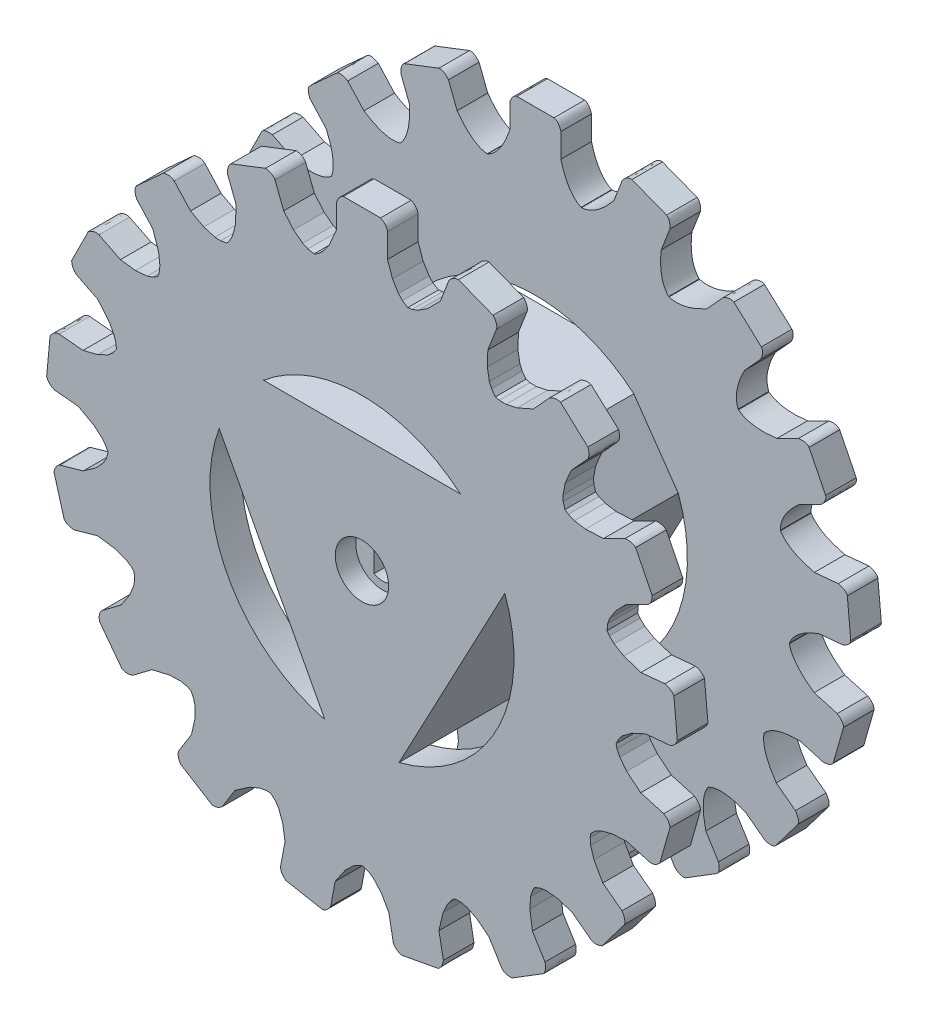
from build123d import *

# Parameters (mm, degrees)
BOSS_EXTRUDE2_DEPTH  = 3
BOSS_EXTRUDE3_DEPTH  = 14
BOSS_EXTRUDE7_DEPTH  = 3
CUT_EXTRUDE1_DEPTH   = 10
SKETCH7_R            = 2.616026973
CUT_EXTRUDE3_DEPTH   = 2
BOSS_EXTRUDE10_DEPTH = 5


with BuildPart() as part:
    # Sketch1 → Boss-Extrude2 (new body)
    with BuildSketch(Plane.XY):
        with BuildLine():
            Line((8.523768733, 28.922958261), (7.673117692, 26.727174809))
            add(Edge.make_bspline(
                [(7.673117692, 26.727174809), (5.977966967, 24.70445358), (4.514634253, 24.588982849)],
                knots=[0, 0, 0, 0.37277567, 0.37277567, 0.37277567], degree=2))
            ThreePointArc((4.514634253, 24.588982849), (4.492443696, 24.593046774), (4.470249482, 24.597090673))
            add(Edge.make_bspline(
                [(2.5, 27.6941981), (3.147445202, 25.23338067), (4.470249482, 24.597090673)],
                knots=[0, 0, 0, 0.37277567, 0.37277567, 0.37277567], degree=2))
            Line((2.5, 27.6941981), (2.5, 30.04899579))
            add(Edge.make_bspline(
                [(2.5, 30.04899579), (2.258646097, 30.79207266), (1.822349431, 30.874685911)],
                knots=[0, 0, 0, 0.57378329, 0.57378329, 0.57378329], degree=2))
            Line((1.822349431, 30.874685911), (-1.822349431, 30.874685911))
            add(Edge.make_bspline(
                [(-2.5, 30.04899579), (-2.258646161, 30.79207266), (-1.822349431, 30.874685911)],
                knots=[0, 0, 0, 0.573783349, 0.573783349, 0.573783349], degree=2))
            Line((-2.5, 30.04899579), (-2.5, 27.6941981))
            add(Edge.make_bspline(
                [(-2.5, 27.6941981), (-3.349989788, 25.195707653), (-4.672794068, 24.559417656)],
                knots=[0, 0, 0, 0.37277567, 0.37277567, 0.37277567], degree=2))
            ThreePointArc((-4.672794068, 24.559417656), (-4.694954204, 24.555190999), (-4.717110518, 24.550944348))
            add(Edge.make_bspline(
                [(-7.673117692, 26.727174809), (-6.180443233, 24.666415078), (-4.717110518, 24.550944348)],
                knots=[0, 0, 0, 0.37277567, 0.37277567, 0.37277567], degree=2))
            Line((-7.673117692, 26.727174809), (-8.523768733, 28.922958261))
            add(Edge.make_bspline(
                [(-8.523768733, 28.922958261), (-9.017254872, 29.528669721), (-9.453932744, 29.448095748)],
                knots=[0, 0, 0, 0.57378329, 0.57378329, 0.57378329], degree=2))
            Line((-9.453932744, 29.448095748), (-12.852513218, 28.131478658))
            add(Edge.make_bspline(
                [(-13.18612988, 27.11674993), (-13.229504455, 27.896835539), (-12.852513218, 28.131478658)],
                knots=[0, 0, 0, 0.573783349, 0.573783349, 0.573783349], degree=2))
            Line((-13.18612988, 27.11674993), (-12.335478839, 24.920966478))
            add(Edge.make_bspline(
                [(-12.335478839, 24.920966478), (-12.22551186, 22.284141794), (-13.229135657, 21.21296702)],
                knots=[0, 0, 0, 0.37277567, 0.37277567, 0.37277567], degree=2))
            ThreePointArc((-13.229135657, 21.21296702), (-13.248272524, 21.201020615), (-13.267398604, 21.189056947))
            add(Edge.make_bspline(
                [(-16.809938321, 22.15049846), (-14.673628561, 20.768113448), (-13.267398604, 21.189056947)],
                knots=[0, 0, 0, 0.37277567, 0.37277567, 0.37277567], degree=2))
            Line((-16.809938321, 22.15049846), (-18.396355267, 23.890714952))
            add(Edge.make_bspline(
                [(-18.396355267, 23.890714952), (-19.075325604, 24.277256312), (-19.453408917, 24.044377078)],
                knots=[0, 0, 0, 0.57378329, 0.57378329, 0.57378329], degree=2))
            Line((-19.453408917, 24.044377078), (-22.146873877, 21.588959331))
            add(Edge.make_bspline(
                [(-22.091399853, 20.522236733), (-22.413644864, 21.233976197), (-22.146873877, 21.588959331)],
                knots=[0, 0, 0, 0.573783349, 0.573783349, 0.573783349], degree=2))
            Line((-22.091399853, 20.522236733), (-20.504982907, 18.782020242))
            add(Edge.make_bspline(
                [(-20.504982907, 18.782020242), (-19.449910811, 16.362979105), (-19.99880917, 15.001587642)],
                knots=[0, 0, 0, 0.37277567, 0.37277567, 0.37277567], degree=2))
            ThreePointArc((-19.99880917, 15.001587642), (-20.012338228, 14.983534918), (-20.025850991, 14.965469993))
            add(Edge.make_bspline(
                [(-23.676483633, 14.582274554), (-21.185059044, 14.064963017), (-20.025850991, 14.965469993)],
                knots=[0, 0, 0, 0.37277567, 0.37277567, 0.37277567], degree=2))
            Line((-23.676483633, 14.582274554), (-25.784412084, 15.631898205))
            add(Edge.make_bspline(
                [(-25.784412084, 15.631898205), (-26.557167913, 15.747064912), (-26.82559442, 15.393332048)],
                knots=[0, 0, 0, 0.57378329, 0.57378329, 0.57378329], degree=2))
            Line((-26.82559442, 15.393332048), (-28.450176499, 12.130731418))
            add(Edge.make_bspline(
                [(-28.013103863, 11.156081748), (-28.570698337, 11.703350707), (-28.450176499, 12.130731418)],
                knots=[0, 0, 0, 0.573783349, 0.573783349, 0.573783349], degree=2))
            Line((-28.013103863, 11.156081748), (-25.905175412, 10.106458097))
            add(Edge.make_bspline(
                [(-25.905175412, 10.106458097), (-24.047491531, 8.231905417), (-24.067532687, 6.764160727)],
                knots=[0, 0, 0, 0.37277567, 0.37277567, 0.37277567], degree=2))
            ThreePointArc((-24.067532687, 6.764160727), (-24.073626762, 6.742439803), (-24.079701234, 6.720713389))
            add(Edge.make_bspline(
                [(-27.345388634, 5.044633666), (-24.835329912, 5.462261394), (-24.079701234, 6.720713389)],
                knots=[0, 0, 0, 0.37277567, 0.37277567, 0.37277567], degree=2))
            Line((-27.345388634, 5.044633666), (-29.690141173, 5.261906986))
            add(Edge.make_bspline(
                [(-29.690141173, 5.261906986), (-30.452317537, 5.090145139), (-30.574834751, 4.663332228)],
                knots=[0, 0, 0, 0.57378329, 0.57378329, 0.57378329], degree=2))
            Line((-30.574834751, 4.663332228), (-30.911125136, 1.034181008))
            add(Edge.make_bspline(
                [(-30.15148297, 0.283236104), (-30.869120683, 0.592122854), (-30.911125136, 1.034181008)],
                knots=[0, 0, 0, 0.573783349, 0.573783349, 0.573783349], degree=2))
            Line((-30.15148297, 0.283236104), (-27.806730432, 0.065962785))
            add(Edge.make_bspline(
                [(-27.806730432, 0.065962785), (-25.397325268, -1.010932712), (-24.885802553, -2.386803576)],
                knots=[0, 0, 0, 0.37277567, 0.37277567, 0.37277567], degree=2))
            ThreePointArc((-24.885802553, -2.386803576), (-24.883638606, -2.409259168), (-24.881454396, -2.431712798))
            add(Edge.make_bspline(
                [(-27.321147375, -5.174312952), (-25.131451858, -3.878148898), (-24.881454396, -2.431712798)],
                knots=[0, 0, 0, 0.37277567, 0.37277567, 0.37277567], degree=2))
            Line((-27.321147375, -5.174312952), (-29.586052178, -5.818733929))
            add(Edge.make_bspline(
                [(-29.586052178, -5.818733929), (-30.234712936, -6.25422694), (-30.194774228, -6.69647645)],
                knots=[0, 0, 0, 0.57378329, 0.57378329, 0.57378329], degree=2))
            Line((-30.194774228, -6.69647645), (-29.19735504, -10.202041278))
            add(Edge.make_bspline(
                [(-28.217737227, -10.627862145), (-28.998497229, -10.599074471), (-29.19735504, -10.202041278)],
                knots=[0, 0, 0, 0.573783349, 0.573783349, 0.573783349], degree=2))
            Line((-28.217737227, -10.627862145), (-25.952832424, -9.983441168))
            add(Edge.make_bspline(
                [(-25.952832424, -9.983441168), (-23.317109497, -10.117238776), (-22.343106886, -11.21541683)],
                knots=[0, 0, 0, 0.37277567, 0.37277567, 0.37277567], degree=2))
            ThreePointArc((-22.343106886, -11.21541683), (-22.33297717, -11.235574338), (-22.322829269, -11.255722697))
            add(Edge.make_bspline(
                [(-23.60703377, -14.694439933), (-22.033431972, -12.694793692), (-22.322829269, -11.255722697)],
                knots=[0, 0, 0, 0.37277567, 0.37277567, 0.37277567], degree=2))
            Line((-23.60703377, -14.694439933), (-25.486202894, -16.113522583))
            add(Edge.make_bspline(
                [(-25.486202894, -16.113522583), (-25.933742816, -16.753931016), (-25.736742131, -17.151888877)],
                knots=[0, 0, 0, 0.57378329, 0.57378329, 0.57378329], degree=2))
            Line((-25.736742131, -17.151888877), (-23.540320357, -20.060421358))
            add(Edge.make_bspline(
                [(-22.473029712, -20.10360872), (-23.211466039, -20.358808058), (-23.540320357, -20.060421358)],
                knots=[0, 0, 0, 0.573783349, 0.573783349, 0.573783349], degree=2))
            Line((-22.473029712, -20.10360872), (-20.593860588, -18.68452607))
            add(Edge.make_bspline(
                [(-20.593860588, -18.68452607), (-18.087788883, -17.857155682), (-16.782850827, -18.529325895)],
                knots=[0, 0, 0, 0.37277567, 0.37277567, 0.37277567], degree=2))
            ThreePointArc((-16.782850827, -18.529325895), (-16.766123417, -18.544462936), (-16.749382354, -18.559584876))
            add(Edge.make_bspline(
                [(-16.704659444, -22.230001378), (-15.959675007, -19.796936253), (-16.749382354, -18.559584876)],
                knots=[0, 0, 0, 0.37277567, 0.37277567, 0.37277567], degree=2))
            Line((-16.704659444, -22.230001378), (-17.944300685, -24.232090725))
            add(Edge.make_bspline(
                [(-17.944300685, -24.232090725), (-18.130277025, -24.990923871), (-17.802820396, -25.290843669)],
                knots=[0, 0, 0, 0.57378329, 0.57378329, 0.57378329], degree=2))
            Line((-17.802820396, -25.290843669), (-14.704034968, -27.209530374))
            add(Edge.make_bspline(
                [(-13.693215007, -26.864251539), (-14.28959774, -27.368971804), (-14.704034968, -27.209530374)],
                knots=[0, 0, 0, 0.573783349, 0.573783349, 0.573783349], degree=2))
            Line((-13.693215007, -26.864251539), (-12.453573765, -24.862162192))
            add(Edge.make_bspline(
                [(-12.453573765, -24.862162192), (-10.415612153, -23.185364764), (-8.955977767, -23.340746822)],
                knots=[0, 0, 0, 0.37277567, 0.37277567, 0.37277567], degree=2))
            ThreePointArc((-8.955977767, -23.340746822), (-8.934911792, -23.348819055), (-8.91383854, -23.356872275))
            add(Edge.make_bspline(
                [(-7.546228296, -26.763277955), (-7.730475497, -24.225392875), (-8.91383854, -23.356872275)],
                knots=[0, 0, 0, 0.37277567, 0.37277567, 0.37277567], degree=2))
            Line((-7.546228296, -26.763277955), (-7.978921236, -29.07798074))
            add(Edge.make_bspline(
                [(-7.978921236, -29.07798074), (-7.878216859, -29.852753978), (-7.464529118, -30.014129882)],
                knots=[0, 0, 0, 0.57378329, 0.57378329, 0.57378329], degree=2))
            Line((-7.464529118, -30.014129882), (-3.88188818, -30.683841541))
            add(Edge.make_bspline(
                [(-3.064055738, -29.996728329), (-3.437840086, -30.682804252), (-3.88188818, -30.683841541)],
                knots=[0, 0, 0, 0.573783349, 0.573783349, 0.573783349], degree=2))
            Line((-3.064055738, -29.996728329), (-2.631362798, -27.682025544))
            add(Edge.make_bspline(
                [(-2.631362798, -27.682025544), (-1.336749286, -25.382261859), (0.080449717, -24.999870557)],
                knots=[0, 0, 0, 0.37277567, 0.37277567, 0.37277567], degree=2))
            ThreePointArc((0.080449717, -24.999870557), (0.103009181, -24.999787781), (0.125568562, -24.999684649))
            add(Edge.make_bspline(
                [(2.631362798, -27.682025544), (1.542767565, -25.382075951), (0.125568562, -24.999684649)],
                knots=[0, 0, 0, 0.37277567, 0.37277567, 0.37277567], degree=2))
            Line((2.631362798, -27.682025544), (3.064055738, -29.996728329))
            add(Edge.make_bspline(
                [(3.064055738, -29.996728329), (3.437840149, -30.68280424), (3.88188818, -30.683841541)],
                knots=[0, 0, 0, 0.57378329, 0.57378329, 0.57378329], degree=2))
            Line((3.88188818, -30.683841541), (7.464529118, -30.014129882))
            add(Edge.make_bspline(
                [(7.978921237, -29.07798074), (7.878216922, -29.852753966), (7.464529118, -30.014129882)],
                knots=[0, 0, 0, 0.573783349, 0.573783349, 0.573783349], degree=2))
            Line((7.978921237, -29.07798074), (7.546228296, -26.763277955))
            add(Edge.make_bspline(
                [(7.546228296, -26.763277955), (7.922648978, -24.151143843), (9.106012021, -23.282623243)],
                knots=[0, 0, 0, 0.37277567, 0.37277567, 0.37277567], degree=2))
            ThreePointArc((9.106012021, -23.282623243), (9.127018193, -23.274396639), (9.148016933, -23.266151082))
            add(Edge.make_bspline(
                [(12.453573766, -24.862162192), (10.607651319, -23.110769024), (9.148016933, -23.266151082)],
                knots=[0, 0, 0, 0.37277567, 0.37277567, 0.37277567], degree=2))
            Line((12.453573766, -24.862162192), (13.693215007, -26.864251539))
            add(Edge.make_bspline(
                [(13.693215007, -26.864251539), (14.289597795, -27.36897177), (14.704034968, -27.209530374)],
                knots=[0, 0, 0, 0.57378329, 0.57378329, 0.57378329], degree=2))
            Line((14.704034968, -27.209530374), (17.802820396, -25.290843669))
            add(Edge.make_bspline(
                [(17.944300685, -24.232090725), (18.13027708, -24.990923837), (17.802820396, -25.290843669)],
                knots=[0, 0, 0, 0.573783349, 0.573783349, 0.573783349], degree=2))
            Line((17.944300685, -24.232090725), (16.704659444, -22.230001378))
            add(Edge.make_bspline(
                [(16.704659444, -22.230001378), (16.112049598, -19.658280024), (16.901756944, -18.420928647)],
                knots=[0, 0, 0, 0.37277567, 0.37277567, 0.37277567], degree=2))
            ThreePointArc((16.901756944, -18.420928647), (16.918372824, -18.405669262), (16.934974927, -18.39039489))
            add(Edge.make_bspline(
                [(20.593860588, -18.68452607), (18.239912983, -17.718224678), (16.934974927, -18.39039489)],
                knots=[0, 0, 0, 0.37277567, 0.37277567, 0.37277567], degree=2))
            Line((20.593860588, -18.68452607), (22.473029712, -20.10360872))
            add(Edge.make_bspline(
                [(22.473029712, -20.10360872), (23.211466078, -20.358808006), (23.540320357, -20.060421357)],
                knots=[0, 0, 0, 0.57378329, 0.57378329, 0.57378329], degree=2))
            Line((23.540320357, -20.060421357), (25.736742131, -17.151888877))
            add(Edge.make_bspline(
                [(25.486202894, -16.113522583), (25.933742855, -16.753930964), (25.736742131, -17.151888877)],
                knots=[0, 0, 0, 0.573783349, 0.573783349, 0.573783349], degree=2))
            Line((25.486202894, -16.113522583), (23.60703377, -14.694439933))
            add(Edge.make_bspline(
                [(23.60703377, -14.694439933), (22.125428639, -12.510456558), (22.414825935, -11.071385563)],
                knots=[0, 0, 0, 0.37277567, 0.37277567, 0.37277567], degree=2))
            ThreePointArc((22.414825935, -11.071385563), (22.424807457, -11.051154263), (22.434770717, -11.030913963))
            add(Edge.make_bspline(
                [(25.952832424, -9.983441168), (23.408773328, -9.93273591), (22.434770717, -11.030913963)],
                knots=[0, 0, 0, 0.37277567, 0.37277567, 0.37277567], degree=2))
            Line((25.952832424, -9.983441168), (28.217737227, -10.627862145))
            add(Edge.make_bspline(
                [(28.217737227, -10.627862145), (28.998497247, -10.599074409), (29.19735504, -10.202041278)],
                knots=[0, 0, 0, 0.57378329, 0.57378329, 0.57378329], degree=2))
            Line((29.19735504, -10.202041278), (30.194774228, -6.69647645))
            add(Edge.make_bspline(
                [(29.586052178, -5.818733929), (30.234712953, -6.254226878), (30.194774228, -6.69647645)],
                knots=[0, 0, 0, 0.573783349, 0.573783349, 0.573783349], degree=2))
            Line((29.586052178, -5.818733929), (27.321147375, -5.174312952))
            add(Edge.make_bspline(
                [(27.321147375, -5.174312952), (25.150645941, -3.673026611), (24.900648479, -2.22659051)],
                knots=[0, 0, 0, 0.37277567, 0.37277567, 0.37277567], degree=2))
            ThreePointArc((24.900648479, -2.22659051), (24.902647582, -2.204119643), (24.904626407, -2.181646981))
            add(Edge.make_bspline(
                [(27.806730432, 0.065962785), (25.416149122, -0.805776117), (24.904626407, -2.181646981)],
                knots=[0, 0, 0, 0.37277567, 0.37277567, 0.37277567], degree=2))
            Line((27.806730432, 0.065962785), (30.15148297, 0.283236104))
            add(Edge.make_bspline(
                [(30.15148297, 0.283236104), (30.869120677, 0.592122918), (30.911125136, 1.034181008)],
                knots=[0, 0, 0, 0.57378329, 0.57378329, 0.57378329], degree=2))
            Line((30.911125136, 1.034181008), (30.574834751, 4.663332228))
            add(Edge.make_bspline(
                [(29.690141173, 5.261906986), (30.452317531, 5.090145204), (30.574834751, 4.663332228)],
                knots=[0, 0, 0, 0.573783349, 0.573783349, 0.573783349], degree=2))
            Line((29.690141173, 5.261906986), (27.345388634, 5.044633666))
            add(Edge.make_bspline(
                [(27.345388634, 5.044633666), (24.779129144, 5.660465933), (24.023500467, 6.918917929)],
                knots=[0, 0, 0, 0.37277567, 0.37277567, 0.37277567], degree=2))
            ThreePointArc((24.023500467, 6.918917929), (24.017247161, 6.940593547), (24.010974298, 6.962263514))
            add(Edge.make_bspline(
                [(25.905175412, 10.106458097), (23.990933142, 8.430008204), (24.010974298, 6.962263514)],
                knots=[0, 0, 0, 0.37277567, 0.37277567, 0.37277567], degree=2))
            Line((25.905175412, 10.106458097), (28.013103863, 11.156081748))
            add(Edge.make_bspline(
                [(28.013103863, 11.156081748), (28.570698308, 11.703350765), (28.450176499, 12.130731418)],
                knots=[0, 0, 0, 0.57378329, 0.57378329, 0.57378329], degree=2))
            Line((28.450176499, 12.130731418), (26.82559442, 15.393332048))
            add(Edge.make_bspline(
                [(25.784412084, 15.631898205), (26.557167884, 15.74706497), (26.82559442, 15.393332048)],
                knots=[0, 0, 0, 0.573783349, 0.573783349, 0.573783349], degree=2))
            Line((25.784412084, 15.631898205), (23.676483633, 14.582274554))
            add(Edge.make_bspline(
                [(23.676483633, 14.582274554), (21.061053651, 14.229481187), (19.901845598, 15.129988162)],
                knots=[0, 0, 0, 0.37277567, 0.37277567, 0.37277567], degree=2))
            ThreePointArc((19.901845598, 15.129988162), (19.888184427, 15.14794112), (19.874507062, 15.165881743))
            add(Edge.make_bspline(
                [(20.504982907, 18.782020242), (19.325608703, 16.527273206), (19.874507062, 15.165881743)],
                knots=[0, 0, 0, 0.37277567, 0.37277567, 0.37277567], degree=2))
            Line((20.504982907, 18.782020242), (22.091399853, 20.522236733))
            add(Edge.make_bspline(
                [(22.091399853, 20.522236733), (22.413644816, 21.23397624), (22.146873877, 21.588959331)],
                knots=[0, 0, 0, 0.57378329, 0.57378329, 0.57378329], degree=2))
            Line((22.146873877, 21.588959331), (19.453408917, 24.044377078))
            add(Edge.make_bspline(
                [(18.396355267, 23.890714952), (19.075325556, 24.277256355), (19.453408917, 24.044377078)],
                knots=[0, 0, 0, 0.573783349, 0.573783349, 0.573783349], degree=2))
            Line((18.396355267, 23.890714952), (16.809938321, 22.15049846))
            add(Edge.make_bspline(
                [(16.809938321, 22.15049846), (14.498566159, 20.876726158), (13.092336201, 21.297669657)],
                knots=[0, 0, 0, 0.37277567, 0.37277567, 0.37277567], degree=2))
            ThreePointArc((13.092336201, 21.297669657), (13.073112182, 21.309475307), (13.053877518, 21.321263606))
            add(Edge.make_bspline(
                [(12.335478839, 24.920966478), (12.050253721, 22.39243838), (13.053877518, 21.321263606)],
                knots=[0, 0, 0, 0.37277567, 0.37277567, 0.37277567], degree=2))
            Line((12.335478839, 24.920966478), (13.18612988, 27.11674993))
            add(Edge.make_bspline(
                [(13.18612988, 27.11674993), (13.229504394, 27.896835562), (12.852513218, 28.131478658)],
                knots=[0, 0, 0, 0.57378329, 0.57378329, 0.57378329], degree=2))
            Line((12.852513218, 28.131478658), (9.453932744, 29.448095748))
            add(Edge.make_bspline(
                [(8.523768733, 28.922958261), (9.017254812, 29.528669744), (9.453932744, 29.448095748)],
                knots=[0, 0, 0, 0.573783349, 0.573783349, 0.573783349], degree=2))
        make_face()
        with BuildLine():
            Line((3.634467092, -14.450668417), (14.001693202, 5.09742643))
            ThreePointArc((14.001693202, 5.09742643), (13.163986498, -6.981448863), (3.634467092, -14.450668417))
        make_face(mode=Mode.SUBTRACT)
        with BuildLine():
            Line((-9.644278202, 11.358656025), (9.644278202, 11.358656025))
            ThreePointArc((9.644278202, 11.358656025), (0, 14.900710343), (-9.644278202, 11.358656025))
        make_face(mode=Mode.SUBTRACT)
        with BuildLine():
            Line((-14.001693202, 5.09742643), (-3.634467092, -14.450668417))
            ThreePointArc((-3.634467092, -14.450668417), (-13.163986498, -6.981448863), (-14.001693202, 5.09742643))
        make_face(mode=Mode.SUBTRACT)
    extrude(amount=BOSS_EXTRUDE2_DEPTH)

    # Sketch2 → Boss-Extrude3 (add)
    with BuildSketch(Plane.XY.offset(3)):
        Polygon((-14.001693202, 5.09742643), (-9.644278202, 11.358656025), (9.644278202, 11.358656025), (14.001693202, 5.09742643), (3.634467092, -14.450668417), (-3.634467092, -14.450668417), align=None)
    extrude(amount=BOSS_EXTRUDE3_DEPTH)

    # Sketch3 → Boss-Extrude7 (add)
    with BuildSketch(Plane.XY.offset(17)):
        with BuildLine():
            Line((-4.337121054, 24.756139353), (-4.694161258, 24.56333699))
            Line((-4.694161258, 24.56333699), (-5.304764946, 24.675338609))
            Line((-5.304764946, 24.675338609), (-5.810986873, 24.906675757))
            Line((-5.810986873, 24.906675757), (-6.709155754, 25.596214612))
            Line((-6.709155754, 25.596214612), (-7.673117692, 26.727174809))
            Line((-7.673117692, 26.727174809), (-8.523768733, 28.922958261))
            add(Edge.make_bspline(
                [(-9.453932744, 29.448095748), (-8.75385581, 29.362411901), (-8.523768733, 28.922958261)],
                knots=[0, 0, 0, 0.68826063, 0.68826063, 0.68826063], degree=2))
            Line((-9.453932744, 29.448095748), (-12.852513218, 28.131478659))
            add(Edge.make_bspline(
                [(-13.18612988, 27.11674993), (-13.216879175, 27.779302095), (-12.852513218, 28.131478658)],
                knots=[0, 0, 0, 0.746925203, 0.746925203, 0.746925203], degree=2))
            Line((-13.18612988, 27.11674993), (-12.335478839, 24.920966478))
            Line((-12.335478839, 24.920966478), (-12.411941504, 23.148059769))
            Line((-12.411941504, 23.148059769), (-12.689350854, 22.087109535))
            Line((-12.689350854, 22.087109535), (-12.987193967, 21.517663618))
            Line((-12.987193967, 21.517663618), (-13.250475795, 21.208902971))
            Line((-13.250475795, 21.208902971), (-13.860306428, 21.092765877))
            Line((-13.860306428, 21.092765877), (-14.415912935, 21.12561289))
            Line((-14.415912935, 21.12561289), (-15.502520638, 21.4441327))
            Line((-15.502520638, 21.4441327), (-16.809938321, 22.15049846))
            Line((-16.809938321, 22.15049846), (-18.396355267, 23.890714952))
            add(Edge.make_bspline(
                [(-19.453408917, 24.044377078), (-18.769654041, 24.217376227), (-18.396355267, 23.890714952)],
                knots=[0, 0, 0, 0.68826063, 0.68826063, 0.68826063], degree=2))
            Line((-19.453408917, 24.044377078), (-22.146873877, 21.588959332))
            add(Edge.make_bspline(
                [(-22.091399853, 20.522236733), (-22.359414165, 21.128940301), (-22.146873877, 21.588959331)],
                knots=[0, 0, 0, 0.746925203, 0.746925203, 0.746925203], degree=2))
            Line((-22.091399853, 20.522236733), (-20.504982907, 18.782020242))
            Line((-20.504982907, 18.782020242), (-19.935834446, 17.10121247))
            Line((-19.935834446, 17.10121247), (-19.811251531, 16.011694024))
            Line((-19.811251531, 16.011694024), (-19.88327437, 15.373108178))
            Line((-19.88327437, 15.373108178), (-20.017240152, 14.990089082))
            Line((-20.017240152, 14.990089082), (-20.543936725, 14.661498233))
            Line((-20.543936725, 14.661498233), (-21.073890073, 14.491418941))
            Line((-21.073890073, 14.491418941), (-22.202184207, 14.395901841))
            Line((-22.202184207, 14.395901841), (-23.676483633, 14.582274554))
            Line((-23.676483633, 14.582274554), (-25.784412084, 15.631898205))
            add(Edge.make_bspline(
                [(-26.82559442, 15.393332048), (-26.250506488, 15.801649701), (-25.784412084, 15.631898205)],
                knots=[0, 0, 0, 0.68826063, 0.68826063, 0.68826063], degree=2))
            Line((-26.82559442, 15.393332048), (-28.450176499, 12.130731418))
            add(Edge.make_bspline(
                [(-28.013103863, 11.156081748), (-28.482186373, 11.62499804), (-28.450176499, 12.130731418)],
                knots=[0, 0, 0, 0.746925203, 0.746925203, 0.746925203], degree=2))
            Line((-28.013103863, 11.156081748), (-25.905175412, 10.106458097))
            Line((-25.905175412, 10.106458097), (-24.767282477, 8.744751665))
            Line((-24.767282477, 8.744751665), (-24.25753291, 7.773810511))
            Line((-24.25753291, 7.773810511), (-24.094008392, 7.152329293))
            Line((-24.094008392, 7.152329293), (-24.080565308, 6.746780601))
            Line((-24.080565308, 6.746780601), (-24.452994529, 6.250114011))
            Line((-24.452994529, 6.250114011), (-24.885721582, 5.900078564))
            Line((-24.885721582, 5.900078564), (-25.903319773, 5.403424668))
            Line((-25.903319773, 5.403424668), (-27.345388634, 5.044633666))
            Line((-27.345388634, 5.044633666), (-29.690141173, 5.261906986))
            add(Edge.make_bspline(
                [(-30.574834751, 4.663332228), (-30.186082574, 5.251822823), (-29.690141173, 5.261906986)],
                knots=[0, 0, 0, 0.68826063, 0.68826063, 0.68826063], degree=2))
            Line((-30.574834751, 4.663332228), (-30.911125136, 1.034181008))
            add(Edge.make_bspline(
                [(-30.15148297, 0.283236104), (-30.758281487, 0.551035377), (-30.911125136, 1.034181008)],
                knots=[0, 0, 0, 0.746925203, 0.746925203, 0.746925203], degree=2))
            Line((-30.15148297, 0.283236104), (-27.806730432, 0.065962785))
            Line((-27.806730432, 0.065962785), (-26.25377177, -0.792736308))
            Line((-26.25377177, -0.792736308), (-25.427700054, -1.513969188))
            Line((-25.427700054, -1.513969188), (-25.050713072, -2.034411296))
            Line((-25.050713072, -2.034411296), (-24.891676683, -2.407717987))
            Line((-24.891676683, -2.407717987), (-25.059539924, -3.005382741))
            Line((-25.059539924, -3.005382741), (-25.336598495, -3.488100116))
            Line((-25.336598495, -3.488100116), (-26.106068468, -4.318814948))
            Line((-26.106068468, -4.318814948), (-27.321147375, -5.174312952))
            Line((-27.321147375, -5.174312952), (-29.586052178, -5.818733929))
            add(Edge.make_bspline(
                [(-30.194774228, -6.69647645), (-30.044860942, -6.007291828), (-29.586052178, -5.818733929)],
                knots=[0, 0, 0, 0.68826063, 0.68826063, 0.68826063], degree=2))
            Line((-30.194774228, -6.69647645), (-29.19735504, -10.202041277))
            add(Edge.make_bspline(
                [(-28.217737227, -10.627862144), (-28.880300249, -10.597347667), (-29.197355039, -10.202041278)],
                knots=[0, 0, 0, 0.746925203, 0.746925203, 0.746925203], degree=2))
            Line((-28.217737227, -10.627862145), (-25.952832424, -9.983441168))
            Line((-25.952832424, -9.983441168), (-24.194543707, -10.22316085))
            Line((-24.194543707, -10.22316085), (-23.163715406, -10.597278959))
            Line((-23.163715406, -10.597278959), (-22.62418014, -10.946393366))
            Line((-22.62418014, -10.946393366), (-22.341029193, -11.237040918))
            Line((-22.341029193, -11.237040918), (-22.281655592, -11.8549859))
            Line((-22.281655592, -11.8549859), (-22.365627386, -12.405191548))
            Line((-22.365627386, -12.405191548), (-22.783047957, -13.457774674))
            Line((-22.783047957, -13.457774674), (-23.60703377, -14.694439933))
            Line((-23.60703377, -14.694439933), (-25.486202894, -16.113522583))
            add(Edge.make_bspline(
                [(-25.73674213, -17.151888877), (-25.845914356, -16.455088431), (-25.486202894, -16.113522583)],
                knots=[0, 0, 0, 0.68826063, 0.68826063, 0.68826063], degree=2))
            Line((-25.736742131, -17.151888877), (-23.540320357, -20.060421357))
            add(Edge.make_bspline(
                [(-22.473029712, -20.10360872), (-23.10187443, -20.314500187), (-23.540320357, -20.060421357)],
                knots=[0, 0, 0, 0.746925203, 0.746925203, 0.746925203], degree=2))
            Line((-22.473029712, -20.10360872), (-20.593860588, -18.68452607))
            Line((-20.593860588, -18.68452607), (-18.867708451, -18.272890871))
            Line((-18.867708451, -18.272890871), (-17.771342637, -18.249367484))
            Line((-17.771342637, -18.249367484), (-17.142126315, -18.380004356))
            Line((-17.142126315, -18.380004356), (-16.773101915, -18.548739207))
            Line((-16.773101915, -18.548739207), (-16.494510205, -19.103507524))
            Line((-16.494510205, -19.103507524), (-16.374054367, -19.646893121))
            Line((-16.374054367, -19.646893121), (-16.383050575, -20.779187358))
            Line((-16.383050575, -20.779187358), (-16.704659444, -22.230001378))
            Line((-16.704659444, -22.230001378), (-17.944300685, -24.232090725))
            add(Edge.make_bspline(
                [(-17.802820396, -25.290843669), (-18.156333818, -24.68053416), (-17.944300685, -24.232090725)],
                knots=[0, 0, 0, 0.68826063, 0.68826063, 0.68826063], degree=2))
            Line((-17.802820396, -25.290843669), (-14.704034969, -27.209530374))
            add(Edge.make_bspline(
                [(-13.693215007, -26.864251539), (-14.203412458, -27.28806689), (-14.704034968, -27.209530374)],
                knots=[0, 0, 0, 0.746925203, 0.746925203, 0.746925203], degree=2))
            Line((-13.693215007, -26.864251539), (-12.453573765, -24.862162192))
            Line((-12.453573765, -24.862162192), (-10.992684619, -23.854765726))
            Line((-10.992684619, -23.854765726), (-9.978851572, -23.436777808))
            Line((-9.978851572, -23.436777808), (-9.344933344, -23.33129391))
            Line((-9.344933344, -23.33129391), (-8.93987428, -23.355327484))
            Line((-8.93987428, -23.355327484), (-8.479689816, -23.771994599))
            Line((-8.479689816, -23.771994599), (-8.171074574, -24.235172911))
            Line((-8.171074574, -24.235172911), (-7.770431431, -25.294255648))
            Line((-7.770431431, -25.294255648), (-7.546228296, -26.763277955))
            Line((-7.546228296, -26.763277955), (-7.978921237, -29.07798074))
            add(Edge.make_bspline(
                [(-7.464529118, -30.014129882), (-8.014639791, -29.572736992), (-7.978921236, -29.077980739)],
                knots=[0, 0, 0, 0.68826063, 0.68826063, 0.68826063], degree=2))
            Line((-7.464529118, -30.014129882), (-3.88188818, -30.683841541))
            add(Edge.make_bspline(
                [(-3.064055738, -29.996728329), (-3.38670093, -30.576228951), (-3.881888179, -30.683841541)],
                knots=[0, 0, 0, 0.746925203, 0.746925203, 0.746925203], degree=2))
            Line((-3.064055738, -29.996728329), (-2.631362798, -27.682025544))
            Line((-2.631362798, -27.682025544), (-1.633037816, -26.214922286))
            Line((-1.633037816, -26.214922286), (-0.838661307, -25.458921421))
            Line((-0.838661307, -25.458921421), (-0.285655343, -25.131562939))
            Line((-0.285655343, -25.131562939), (0.100732914, -25.007649367))
            Line((0.100732914, -25.007649367), (0.68035967, -25.229942079))
            Line((0.68035967, -25.229942079), (1.135454118, -25.550358308))
            Line((1.135454118, -25.550358308), (1.891627535, -26.393194552))
            Line((1.891627535, -26.393194552), (2.631362798, -27.682025544))
            Line((2.631362798, -27.682025544), (3.064055738, -29.996728329))
            add(Edge.make_bspline(
                [(3.88188818, -30.683841541), (3.209475751, -30.470977824), (3.064055738, -29.996728329)],
                knots=[0, 0, 0, 0.68826063, 0.68826063, 0.68826063], degree=2))
            Line((3.88188818, -30.683841541), (7.464529118, -30.014129882))
            add(Edge.make_bspline(
                [(7.978921237, -29.077980739), (7.887403326, -29.734901863), (7.464529118, -30.014129882)],
                knots=[0, 0, 0, 0.746925203, 0.746925203, 0.746925203], degree=2))
            Line((7.978921237, -29.07798074), (7.546228296, -26.763277955))
            Line((7.546228296, -26.763277955), (7.947159792, -25.03460833))
            Line((7.947159792, -25.03460833), (8.414794815, -24.042696624))
            Line((8.414794815, -24.042696624), (8.812201996, -23.537675134))
            Line((8.812201996, -23.537675134), (9.12773557, -23.282549632))
            Line((9.12773557, -23.282549632), (9.748522813, -23.280446078))
            Line((9.748522813, -23.280446078), (10.28863344, -23.414826236))
            Line((10.28863344, -23.414826236), (11.298211721, -23.927586283))
            Line((11.298211721, -23.927586283), (12.453573765, -24.862162192))
            Line((12.453573765, -24.862162192), (13.693215007, -26.864251539))
            add(Edge.make_bspline(
                [(14.704034968, -27.209530374), (14.000133808, -27.253944256), (13.693215007, -26.864251539)],
                knots=[0, 0, 0, 0.68826063, 0.68826063, 0.68826063], degree=2))
            Line((14.704034968, -27.209530374), (17.802820396, -25.290843669))
            add(Edge.make_bspline(
                [(17.944300685, -24.232090725), (18.096270056, -24.877711512), (17.802820396, -25.290843669)],
                knots=[0, 0, 0, 0.746925203, 0.746925203, 0.746925203], degree=2))
            Line((17.944300685, -24.232090725), (16.704659444, -22.230001378))
            Line((16.704659444, -22.230001378), (16.454049434, -20.473231796))
            Line((16.454049434, -20.473231796), (16.531786269, -19.379372422))
            Line((16.531786269, -19.379372422), (16.719922624, -18.764893876))
            Line((16.719922624, -18.764893876), (16.921986959, -18.413012556))
            Line((16.921986959, -18.413012556), (17.500093932, -18.186796832))
            Line((17.500093932, -18.186796832), (18.052275804, -18.116992135))
            Line((18.052275804, -18.116992135), (19.178909808, -18.230424898))
            Line((19.178909808, -18.230424898), (20.593860588, -18.68452607))
            Line((20.593860588, -18.68452607), (22.473029712, -20.10360872))
            add(Edge.make_bspline(
                [(23.540320357, -20.060421357), (22.899996217, -20.356114497), (22.473029712, -20.10360872)],
                knots=[0, 0, 0, 0.68826063, 0.68826063, 0.68826063], degree=2))
            Line((23.540320357, -20.060421358), (25.73674213, -17.151888877))
            add(Edge.make_bspline(
                [(25.486202894, -16.113522583), (25.861135241, -16.660648369), (25.736742131, -17.151888877)],
                knots=[0, 0, 0, 0.746925203, 0.746925203, 0.746925203], degree=2))
            Line((25.486202894, -16.113522583), (23.60703377, -14.694439933))
            Line((23.60703377, -14.694439933), (22.738728525, -13.146831863))
            Line((22.738728525, -13.146831863), (22.416068382, -12.09875659))
            Line((22.416068382, -12.09875659), (22.369525054, -11.457809719))
            Line((22.369525054, -11.457809719), (22.43083024, -11.056696104))
            Line((22.43083024, -11.056696104), (22.888180393, -10.636919897))
            Line((22.888180393, -10.636919897), (23.37785829, -10.372357856))
            Line((23.37785829, -10.372357856), (24.469389852, -10.071143613))
            Line((24.469389852, -10.071143613), (25.952832424, -9.983441168))
            Line((25.952832424, -9.983441168), (28.217737227, -10.627862145))
            add(Edge.make_bspline(
                [(29.197355039, -10.202041278), (28.707087244, -10.709078677), (28.217737227, -10.627862144)],
                knots=[0, 0, 0, 0.68826063, 0.68826063, 0.68826063], degree=2))
            Line((29.19735504, -10.202041278), (30.194774228, -6.69647645))
            add(Edge.make_bspline(
                [(29.586052178, -5.818733929), (30.13331081, -6.193472344), (30.194774228, -6.69647645)],
                knots=[0, 0, 0, 0.746925203, 0.746925203, 0.746925203], degree=2))
            Line((29.586052178, -5.818733929), (27.321147375, -5.174312952))
            Line((27.321147375, -5.174312952), (25.952416329, -4.044879438))
            Line((25.952416329, -4.044879438), (25.272936248, -3.184136639))
            Line((25.272936248, -3.184136639), (24.997999172, -2.603284871))
            Line((24.997999172, -2.603284871), (24.910265605, -2.207111576))
            Line((24.910265605, -2.207111576), (25.185091265, -1.650467989))
            Line((25.185091265, -1.650467989), (25.546131473, -1.226879173))
            Line((25.546131473, -1.226879173), (26.455143207, -0.551698577))
            Line((26.455143207, -0.551698577), (27.806730432, 0.065962785))
            Line((27.806730432, 0.065962785), (30.15148297, 0.283236104))
            add(Edge.make_bspline(
                [(30.911125136, 1.034181008), (30.637127067, 0.384277558), (30.15148297, 0.283236104)],
                knots=[0, 0, 0, 0.68826063, 0.68826063, 0.68826063], degree=2))
            Line((30.911125136, 1.034181008), (30.574834751, 4.663332228))
            add(Edge.make_bspline(
                [(29.690141173, 5.261906986), (30.335815779, 5.11016644), (30.574834751, 4.663332228)],
                knots=[0, 0, 0, 0.746925203, 0.746925203, 0.746925203], degree=2))
            Line((29.690141173, 5.261906986), (27.345388634, 5.044633666))
            Line((27.345388634, 5.044633666), (25.6610865, 5.603356369))
            Line((25.6610865, 5.603356369), (24.716554031, 6.16051861))
            Line((24.716554031, 6.16051861), (24.250354983, 6.602828025))
            Line((24.250354983, 6.602828025), (24.025431567, 6.940555601))
            Line((24.025431567, 6.940555601), (24.080616006, 7.558888766))
            Line((24.080616006, 7.558888766), (24.264258044, 8.08429634))
            Line((24.264258044, 8.08429634), (24.867982878, 9.042256409))
            Line((24.867982878, 9.042256409), (25.905175412, 10.106458097))
            Line((25.905175412, 10.106458097), (28.013103863, 11.156081748))
            add(Edge.make_bspline(
                [(28.450176499, 12.130731418), (28.429453113, 11.42573498), (28.013103863, 11.156081748)],
                knots=[0, 0, 0, 0.68826063, 0.68826063, 0.68826063], degree=2))
            Line((28.450176499, 12.130731418), (26.82559442, 15.393332048))
            add(Edge.make_bspline(
                [(25.784412084, 15.631898205), (26.441300731, 15.72364893), (26.82559442, 15.393332048)],
                knots=[0, 0, 0, 0.746925203, 0.746925203, 0.746925203], degree=2))
            Line((25.784412084, 15.631898205), (23.676483633, 14.582274554))
            Line((23.676483633, 14.582274554), (21.904084747, 14.494827849))
            Line((21.904084747, 14.494827849), (20.822064234, 14.673161683))
            Line((20.822064234, 14.673161683), (20.227565977, 14.917192409))
            Line((20.227565977, 14.917192409), (19.895829866, 15.150862284))
            Line((19.895829866, 15.150862284), (19.72392012, 15.747375708))
            Line((19.72392012, 15.747375708), (19.705362113, 16.303642836))
            Line((19.705362113, 16.303642836), (19.922263664, 17.415004563))
            Line((19.922263664, 17.415004563), (20.504982907, 18.782020242))
            Line((20.504982907, 18.782020242), (22.091399853, 20.522236733))
            add(Edge.make_bspline(
                [(22.146873877, 21.588959331), (22.382223984, 20.924083581), (22.091399853, 20.522236733)],
                knots=[0, 0, 0, 0.68826063, 0.68826063, 0.68826063], degree=2))
            Line((22.146873877, 21.588959331), (19.453408917, 24.044377077))
            add(Edge.make_bspline(
                [(18.396355267, 23.890714952), (18.975741503, 24.213565505), (19.453408917, 24.044377078)],
                knots=[0, 0, 0, 0.746925203, 0.746925203, 0.746925203], degree=2))
            Line((18.396355267, 23.890714952), (16.809938321, 22.15049846))
            Line((16.809938321, 22.15049846), (15.188814973, 21.42869251))
            Line((15.188814973, 21.42869251), (14.115439282, 21.204112964))
            Line((14.115439282, 21.204112964), (13.472932102, 21.216907298))
            Line((13.472932102, 21.216907298), (13.079186095, 21.314961062))
            Line((13.079186095, 21.314961062), (12.703399528, 21.809092302))
            Line((12.703399528, 21.809092302), (12.485147838, 22.321092025))
            Line((12.485147838, 22.321092025), (12.285932349, 23.43575985))
            Line((12.285932349, 23.43575985), (12.335478839, 24.920966478))
            Line((12.335478839, 24.920966478), (13.18612988, 27.11674993))
            add(Edge.make_bspline(
                [(12.852513218, 28.131478658), (13.312151481, 27.59651875), (13.18612988, 27.11674993)],
                knots=[0, 0, 0, 0.68826063, 0.68826063, 0.68826063], degree=2))
            Line((12.852513218, 28.131478658), (9.453932745, 29.448095748))
            add(Edge.make_bspline(
                [(8.523768733, 28.922958261), (8.947403237, 29.433305886), (9.453932744, 29.448095748)],
                knots=[0, 0, 0, 0.746925203, 0.746925203, 0.746925203], degree=2))
            Line((8.523768733, 28.922958261), (7.673117692, 26.727174809))
            Line((7.673117692, 26.727174809), (6.422211574, 25.468493506))
            Line((6.422211574, 25.468493506), (5.502446039, 24.871331293))
            Line((5.502446039, 24.871331293), (4.89870409, 24.65116129))
            Line((4.89870409, 24.65116129), (4.496125768, 24.600356239))
            Line((4.496125768, 24.600356239), (3.967214437, 24.925370132))
            Line((3.967214437, 24.925370132), (3.578745165, 25.323954051))
            Line((3.578745165, 25.323954051), (2.990317791, 26.291385907))
            Line((2.990317791, 26.291385907), (2.5, 27.6941981))
            Line((2.5, 27.6941981), (2.5, 30.04899579))
            add(Edge.make_bspline(
                [(1.822349431, 30.874685911), (2.444199155, 30.541891144), (2.5, 30.04899579)],
                knots=[0, 0, 0, 0.68826063, 0.68826063, 0.68826063], degree=2))
            Line((1.822349431, 30.874685911), (-1.822349431, 30.874685911))
            add(Edge.make_bspline(
                [(-2.5, 30.04899579), (-2.289331416, 30.677915211), (-1.822349431, 30.874685911)],
                knots=[0, 0, 0, 0.746925203, 0.746925203, 0.746925203], degree=2))
            Line((-2.5, 30.04899579), (-2.5, 27.6941981))
            Line((-2.5, 27.6941981), (-3.211747086, 26.068633329))
            Line((-3.211747086, 26.068633329), (-3.853683031, 25.179538515))
            Line((-3.853683031, 25.179538515), (-4.337121054, 24.756139353))
        make_face()
        with BuildLine():
            ThreePointArc((-3.634467092, -14.450668417), (-13.163986498, -6.981448863), (-14.001693202, 5.09742643))
            Line((-14.001693202, 5.09742643), (-3.634467092, -14.450668417))
        make_face(mode=Mode.SUBTRACT)
        with BuildLine():
            ThreePointArc((14.001693202, 5.09742643), (13.163986498, -6.981448863), (3.634467092, -14.450668417))
            Line((3.634467092, -14.450668417), (14.001693202, 5.09742643))
        make_face(mode=Mode.SUBTRACT)
        with BuildLine():
            Line((9.644278202, 11.358656025), (-9.644278202, 11.358656025))
            ThreePointArc((-9.644278202, 11.358656025), (0, 14.900710343), (9.644278202, 11.358656025))
        make_face(mode=Mode.SUBTRACT)
    extrude(amount=BOSS_EXTRUDE7_DEPTH)

    # Sketch6 → Cut-Extrude1 (cut)
    with BuildSketch(Plane.XY.offset(20)):
        with BuildLine():
            ThreePointArc((-0.829483167, -1.653619568), (0.032194698, -1.849719844), (0.886526395, -1.623752121))
            Line((0.886526395, -1.623752121), (0.886526395, 1.623752121))
            ThreePointArc((0.886526395, 1.623752121), (0.863570713, 1.636076289), (0.840443742, 1.648075944))
            ThreePointArc((0.840443742, 1.648075944), (0.006141376, 1.849989806), (-0.829483167, 1.653619568))
            Line((-0.829483167, 1.653619568), (-0.829483167, -1.653619568))
        make_face()
    extrude(amount=-CUT_EXTRUDE1_DEPTH, mode=Mode.SUBTRACT)

    # Sketch7 → Cut-Extrude3 (cut)
    with BuildSketch(Plane.XY.offset(20)):
        Circle(SKETCH7_R)
    extrude(amount=-CUT_EXTRUDE3_DEPTH, mode=Mode.SUBTRACT)

    # Sketch8 → Boss-Extrude10 (add)
    with BuildSketch(Plane(origin=(0, 0, 0), x_dir=(-1, 0, 0), z_dir=(0, 0, -1))):
        Polygon((0, -5.992650485), (5.189787556, -2.996325242), (5.189787556, 2.996325242), (0, 5.992650485), (-5.189787556, 2.996325242), (-5.189787556, -2.996325242), align=None)
    extrude(amount=BOSS_EXTRUDE10_DEPTH)


solid = part.part
